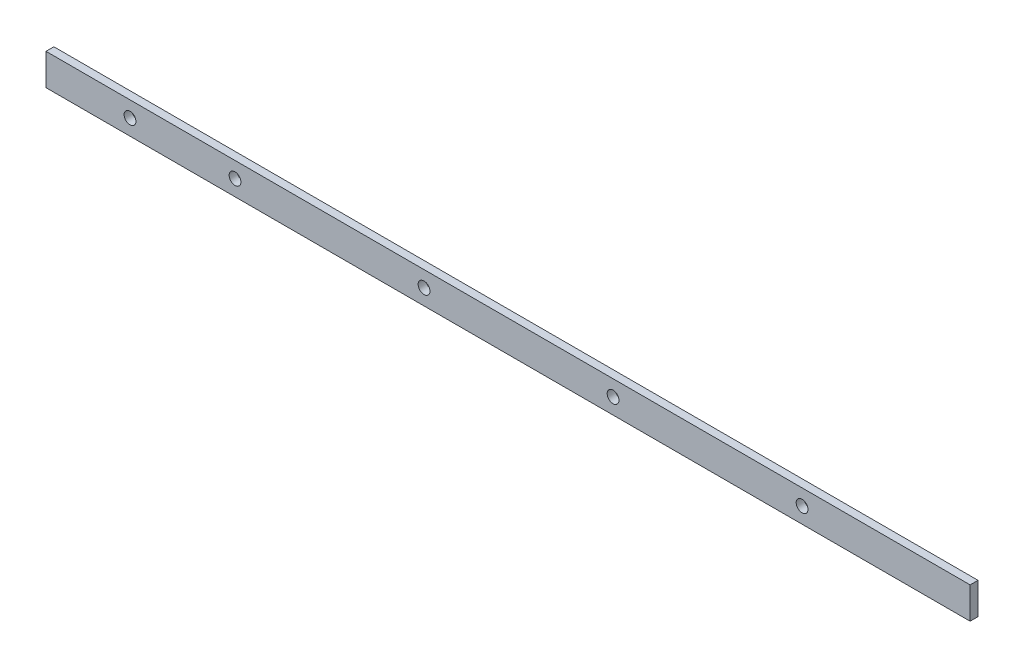
from build123d import *

# Parameters (mm, degrees)
SKETCH1_W           = 558.8
SKETCH1_H           = 19.05
BOSS_EXTRUDE1_DEPTH = 4.7752
SKETCH2_R           = 3.5687
CUT_EXTRUDE1_DEPTH  = 560.145012528


with BuildPart() as part:
    # Sketch1 → Boss-Extrude1 (new body)
    with BuildSketch(Plane.XY):
        with Locations((279.4, 9.525)):
            Rectangle(SKETCH1_W, SKETCH1_H)
    extrude(amount=BOSS_EXTRUDE1_DEPTH)

    # Sketch2 → Cut-Extrude1 (cut, through all)
    with BuildSketch(Plane.XY):
        with Locations((50.8, 9.525)):
            Circle(SKETCH2_R)
        with Locations((114.3, 9.525)):
            Circle(SKETCH2_R)
        with Locations((228.6, 9.525)):
            Circle(SKETCH2_R)
        with Locations((342.9, 9.525)):
            Circle(SKETCH2_R)
        with Locations((457.2, 9.525)):
            Circle(SKETCH2_R)
    extrude(amount=CUT_EXTRUDE1_DEPTH, mode=Mode.SUBTRACT)


solid = part.part
